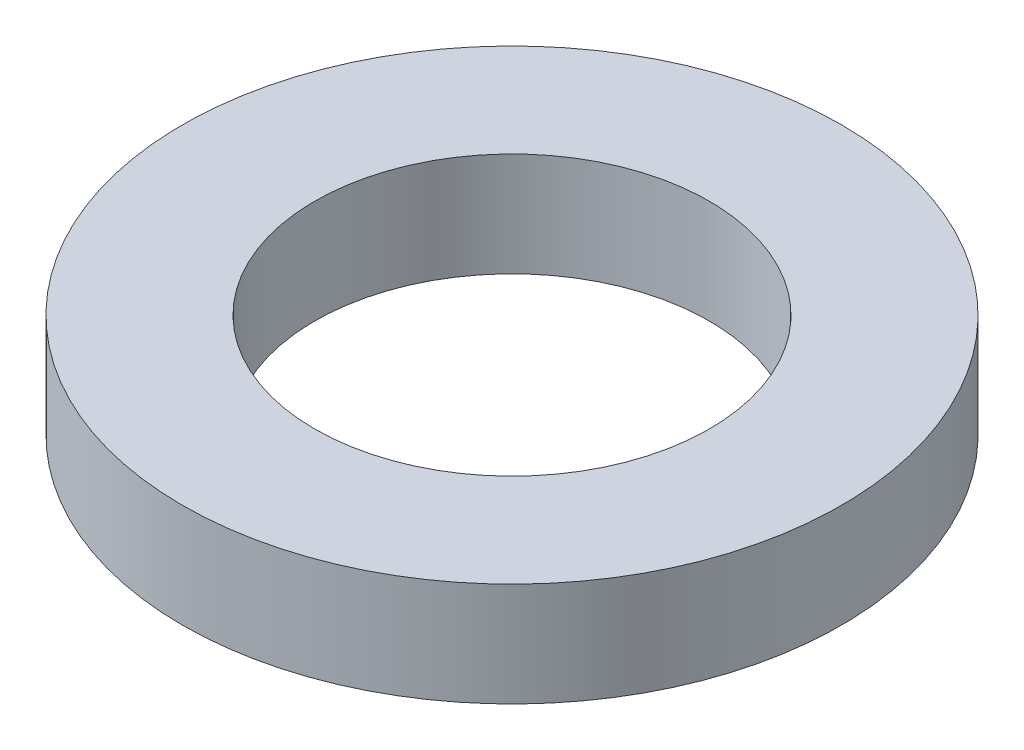
from build123d import *

# Parameters (mm, degrees)
SKETCH1_R           = 6.35
SKETCH1_R_2         = 3.802
BOSS_EXTRUDE1_DEPTH = 2


with BuildPart() as part:
    # Sketch1 → Boss-Extrude1 (new body)
    with BuildSketch(Plane(origin=(0, 0, 0), x_dir=(1, 0, 0), z_dir=(0, 1, 0))):
        with Locations(Location((0, 0, 0), (0, 0, 270))):
            Circle(SKETCH1_R)
        with Locations(Location((0, 0, 0), (0, 0, 270))):
            Circle(SKETCH1_R_2, mode=Mode.SUBTRACT)
    extrude(amount=BOSS_EXTRUDE1_DEPTH)


solid = part.part
